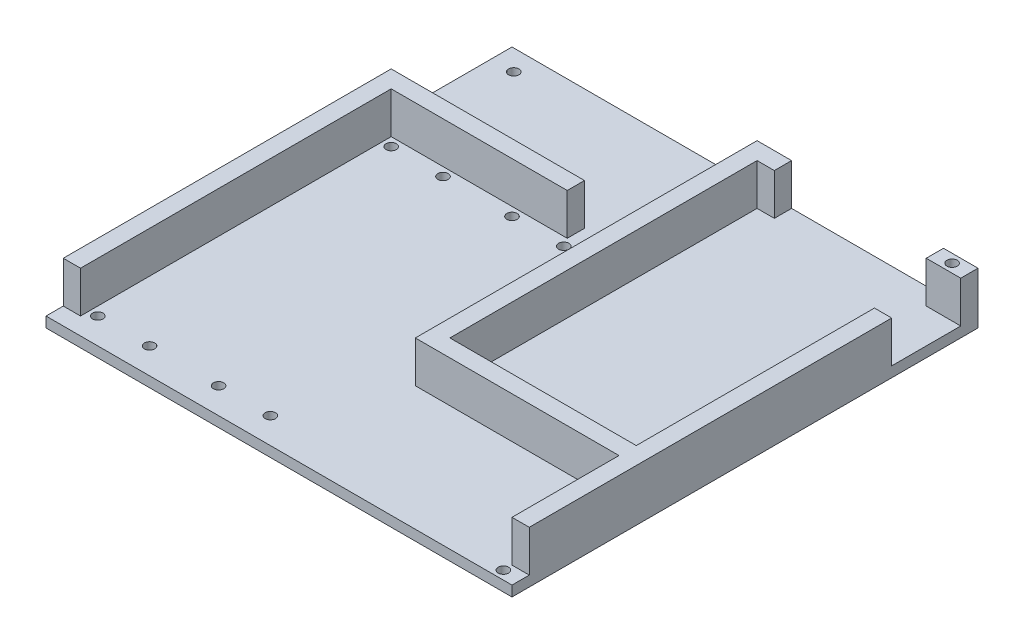
from build123d import *

# Parameters (mm, degrees)
SKETCH1_W           = 130
SKETCH1_H           = 130
SKETCH1_W_2         = 5
BOSS_EXTRUDE1_DEPTH = 3
SKETCH7_R           = 1.5
CUT_EXTRUDE3_DEPTH  = 3
SKETCH8_W           = 10
SKETCH8_H           = 5
BOSS_EXTRUDE5_DEPTH = 12
SKETCH9_R           = 1.5
CUT_EXTRUDE4_DEPTH  = 9
SKETCH10_W          = 5
SKETCH10_H          = 90
BOSS_EXTRUDE6_DEPTH = 12
SKETCH12_R          = 1.5
BOSS_EXTRUDE7_DEPTH = 3
CUT_EXTRUDE5_DEPTH  = 10


with BuildPart() as part:
    # Sketch1 → Boss-Extrude1 (new body)
    with BuildSketch(Plane(origin=(0, 0, 0), x_dir=(1, 0, 0), z_dir=(0, 1, 0))):
        Rectangle(SKETCH1_W, SKETCH1_H)
        with Locations((-67.5, 0)):
            Rectangle(SKETCH1_W_2, SKETCH1_H)
    extrude(amount=BOSS_EXTRUDE1_DEPTH)

    # Sketch7 → Cut-Extrude3 (cut)
    with BuildSketch(Plane(origin=(0, 3, 0), x_dir=(1, 0, 0), z_dir=(0, 1, 0))):
        with Locations(Location((-47.5, -62.5, 0), (0, 0, 270))):
            Circle(SKETCH7_R)
        with Locations(Location((-62.5, -62.5, 0), (0, 0, 270))):
            Circle(SKETCH7_R)
        with Locations(Location((-62.5, 22.5, 0), (0, 0, 270))):
            Circle(SKETCH7_R)
        with Locations(Location((-47.5, 22.5, 0), (0, 0, 90))):
            Circle(SKETCH7_R)
        with Locations(Location((-27.5, 22.5, 0), (0, 0, 270))):
            Circle(SKETCH7_R)
        with Locations(Location((-12.5, 22.5, 0), (0, 0, 90))):
            Circle(SKETCH7_R)
        with Locations(Location((-27.5, -62.5, 0), (0, 0, 90))):
            Circle(SKETCH7_R)
        with Locations(Location((-12.5, -62.5, 0), (0, 0, 270))):
            Circle(SKETCH7_R)
    extrude(amount=-CUT_EXTRUDE3_DEPTH, mode=Mode.SUBTRACT)

    # Sketch8 → Boss-Extrude5 (add)
    with BuildSketch(Plane(origin=(0, 3, 0), x_dir=(1, 0, 0), z_dir=(0, 1, 0))):
        Polygon((60, -65), (65, -65), (65, 40), (60, 40), (60, -29), (6, -29), (6, 60), (11, 60), (11, 65), (1, 65), (1, -34), (60, -34), align=None)
        with Locations((60, 62.5)):
            Rectangle(SKETCH8_W, SKETCH8_H)
    extrude(amount=BOSS_EXTRUDE5_DEPTH)

    # Sketch9 → Cut-Extrude4 (cut)
    with BuildSketch(Plane(origin=(0, 3, 0), x_dir=(1, 0, 0), z_dir=(0, 1, 0))):
        with Locations(Location((-63.5, 59, 0), (0, 0, 270))):
            Circle(SKETCH9_R)
        with Locations(Location((-63.5, 36, 0), (0, 0, 270))):
            Circle(SKETCH9_R)
        with Locations(Location((-5.5, 36, 0), (0, 0, 270))):
            Circle(SKETCH9_R)
        with Locations(Location((-5.5, 59, 0), (0, 0, 270))):
            Circle(SKETCH9_R)
    extrude(amount=-CUT_EXTRUDE4_DEPTH, mode=Mode.SUBTRACT)

    # Sketch10 → Boss-Extrude6 (add)
    with BuildSketch(Plane(origin=(0, 3, 0), x_dir=(1, 0, 0), z_dir=(0, 1, 0))):
        Polygon((-70, 30), (-70, 25), (-65, 25), (-14, 25), (-14, 30), align=None)
        with Locations((-67.5, -20)):
            Rectangle(SKETCH10_W, SKETCH10_H)
    extrude(amount=BOSS_EXTRUDE6_DEPTH)

    # Sketch12 → Boss-Extrude7 (add)
    with BuildSketch(Plane(origin=(0, 0, 0), x_dir=(1, 0, 0), z_dir=(0, 1, 0))):
        Polygon((65, -65), (60, -65), (-65, -65), (-70, -65), (-70, -70), (65, -70), align=None)
        with Locations(Location((60, -67.5, 0), (0, 0, 270))):
            Circle(SKETCH12_R, mode=Mode.SUBTRACT)
    extrude(amount=BOSS_EXTRUDE7_DEPTH)

    # Sketch13 → Cut-Extrude5 (cut)
    with BuildSketch(Plane(origin=(0, 15, 0), x_dir=(1, 0, 0), z_dir=(0, 1, 0))):
        with BuildLine():
            ThreePointArc((61.5, 62.5), (61.060660172, 63.560660172), (60, 64))
            Line((60, 64), (60, 61))
            ThreePointArc((60, 61), (61.060660172, 61.439339828), (61.5, 62.5))
        make_face()
        with BuildLine():
            Line((60, 61), (60, 64))
            ThreePointArc((60, 64), (58.5, 62.5), (60, 61))
        make_face()
    extrude(amount=-CUT_EXTRUDE5_DEPTH, mode=Mode.SUBTRACT)


solid = part.part
